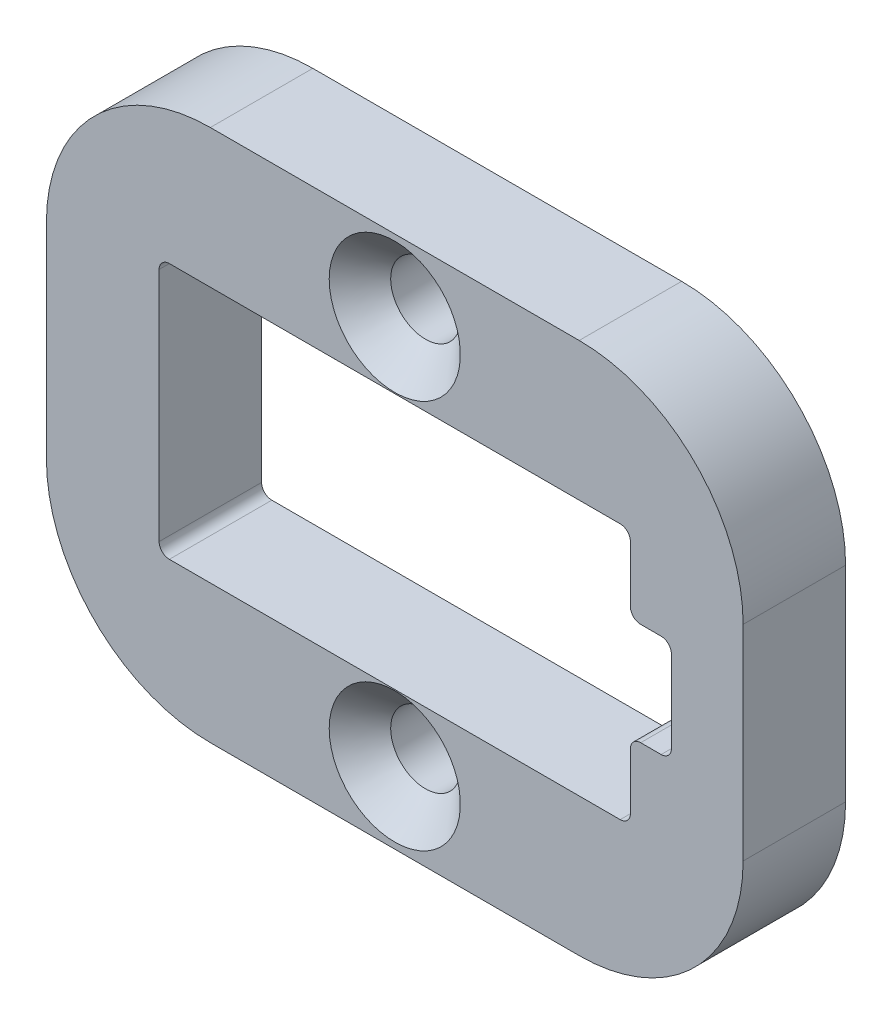
from build123d import *

# Parameters (mm, degrees)
SKETCH1_R           = 1.699999809
SKETCH1_R_2         = 1.70000044
BOSS_EXTRUDE1_DEPTH = 5
CHAMFER1_SIZE       = 1.5


with BuildPart() as part:
    # Sketch1 → Boss-Extrude1 (new body)
    with BuildSketch(Plane.XY):
        with BuildLine():
            Line((34.170001984, 18.130024456), (34.170001984, 8.129999593))
            ThreePointArc((34.170001984, 8.129999593), (31.826856233, 2.473145343), (26.170001984, 0.129999593))
            Line((26.170001984, 0.129999593), (8.170027525, 0.129999593))
            ThreePointArc((8.170027525, 0.129999593), (2.513173276, 2.473145343), (0.170027525, 8.129999593))
            Line((0.170027525, 8.129999593), (0.170027525, 18.130024456))
            ThreePointArc((0.170027525, 18.130024456), (2.513173276, 23.786878706), (8.170027525, 26.130024456))
            Line((8.170027525, 26.130024456), (26.170001984, 26.130024456))
            ThreePointArc((26.170001984, 26.130024456), (31.826856233, 23.786878706), (34.170001984, 18.130024456))
        make_face()
        with Locations((17.17000103, 3.630000114)):
            Circle(SKETCH1_R, mode=Mode.SUBTRACT)
        with Locations((17.170001507, 22.630000114)):
            Circle(SKETCH1_R_2, mode=Mode.SUBTRACT)
        with BuildLine():
            Line((30.170001984, 15.629999161), (29.170001984, 15.629999161))
            ThreePointArc((29.170001984, 15.629999161), (28.816448593, 15.77644577), (28.670001984, 16.129999161))
            Line((28.670001984, 16.129999161), (28.670001984, 18.879999161))
            ThreePointArc((28.670001984, 18.879999161), (28.523555374, 19.233552551), (28.170001984, 19.379999161))
            Line((28.170001984, 19.379999161), (6.17000103, 19.379999161))
            ThreePointArc((6.17000103, 19.379999161), (5.816447639, 19.233552551), (5.67000103, 18.879999161))
            Line((5.67000103, 18.879999161), (5.67000103, 7.379999638))
            ThreePointArc((5.67000103, 7.379999638), (5.816447639, 7.026446247), (6.17000103, 6.879999638))
            Line((6.17000103, 6.879999638), (28.170001984, 6.879999638))
            ThreePointArc((28.170001984, 6.879999638), (28.523555374, 7.026446247), (28.670001984, 7.379999638))
            Line((28.670001984, 7.379999638), (28.670001984, 10.130000114))
            ThreePointArc((28.670001984, 10.130000114), (28.816448593, 10.483553505), (29.170001984, 10.630000114))
            Line((29.170001984, 10.630000114), (30.170001984, 10.630000114))
            ThreePointArc((30.170001984, 10.630000114), (30.523555374, 10.776446724), (30.670001984, 11.130000114))
            Line((30.670001984, 11.130000114), (30.670001984, 15.129999161))
            ThreePointArc((30.670001984, 15.129999161), (30.523555374, 15.483552551), (30.170001984, 15.629999161))
        make_face(mode=Mode.SUBTRACT)
    extrude(amount=BOSS_EXTRUDE1_DEPTH)

    # Chamfer1
    chamfer1_edges = [part.edges().sort_by_distance(p)[0] for p in [
        (15.470001221, 3.630000114, 5),
        (15.470001067, 22.630000114, 5),
    ]]
    chamfer(chamfer1_edges, length=CHAMFER1_SIZE)


solid = part.part
